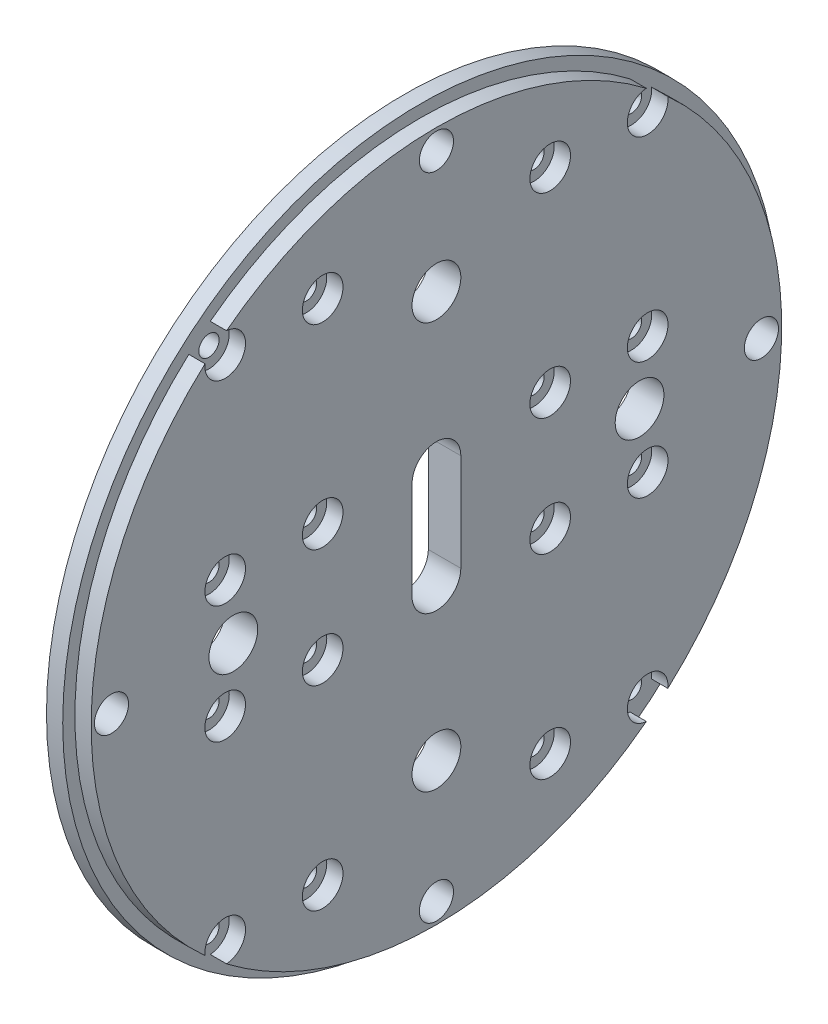
from build123d import *

# Parameters (mm, degrees)
CROQUIS1_R              = 44
SALIENTE_EXTRUIR1_DEPTH = 4
CROQUIS2_R              = 1.25
CORTAR_EXTRUIR2_DEPTH   = 63.353829072
CORTAR_EXTRUIR3_START   = -2
CROQUIS3_R              = 2.5
CORTAR_EXTRUIR3_DEPTH   = 61.353829072
CROQUIS4_R              = 3
CORTAR_EXTRUIR4_DEPTH   = 63.353829072
CROQUIS5_OUTSIDE_W      = 114.904
CROQUIS5_OUTSIDE_H      = 114.904
CROQUIS5_OUTSIDE_R      = 42.5
CORTAR_EXTRUIR5_DEPTH   = 2
CROQUIS6_R              = 2.1
CORTAR_EXTRUIR6_DEPTH   = 63.353829072


with BuildPart() as part:
    # Croquis1 → Saliente-Extruir1 (new body)
    with BuildSketch(Plane(origin=(0, 0, 0), x_dir=(0, 0, -1), z_dir=(1, 0, 0))):
        Circle(CROQUIS1_R)
    extrude(amount=SALIENTE_EXTRUIR1_DEPTH)

    # Croquis2 → Cortar-Extruir2 (cut, through all)
    with BuildSketch(Plane.ZY):
        with Locations((14, 7.25)):
            Circle(CROQUIS2_R)
        with Locations((26, 7.25)):
            Circle(CROQUIS2_R)
        with Locations((26, 31.25)):
            Circle(CROQUIS2_R)
        with Locations((14, 31.25)):
            Circle(CROQUIS2_R)
        with Locations(Location((-26, 31.25, 0), (0, 0, 180))):
            Circle(CROQUIS2_R)
        with Locations(Location((-14, 31.25, 0), (0, 0, 180))):
            Circle(CROQUIS2_R)
        with Locations(Location((-26, 7.25, 0), (0, 0, 180))):
            Circle(CROQUIS2_R)
        with Locations(Location((-14, 7.25, 0), (0, 0, 180))):
            Circle(CROQUIS2_R)
        with Locations((-14, -7.25)):
            Circle(CROQUIS2_R)
        with Locations((-26, -7.25)):
            Circle(CROQUIS2_R)
        with Locations((-14, -31.25)):
            Circle(CROQUIS2_R)
        with Locations((-26, -31.25)):
            Circle(CROQUIS2_R)
        with Locations(Location((14, -31.25, 0), (0, 0, 180))):
            Circle(CROQUIS2_R)
        with Locations(Location((26, -31.25, 0), (0, 0, 180))):
            Circle(CROQUIS2_R)
        with Locations(Location((26, -7.25, 0), (0, 0, 180))):
            Circle(CROQUIS2_R)
        with Locations(Location((14, -7.25, 0), (0, 0, 180))):
            Circle(CROQUIS2_R)
    extrude(amount=-CORTAR_EXTRUIR2_DEPTH, mode=Mode.SUBTRACT)

    # Croquis3 → Cortar-Extruir3 (cut, through all)
    with BuildSketch(Plane.ZY.offset(CORTAR_EXTRUIR3_START)):
        with Locations((14, 7.25)):
            Circle(CROQUIS3_R)
        with Locations((26, 7.25)):
            Circle(CROQUIS3_R)
        with Locations((26, 31.25)):
            Circle(CROQUIS3_R)
        with Locations((14, 31.25)):
            Circle(CROQUIS3_R)
        with Locations(Location((-26, 31.25, 0), (0, 0, 180))):
            Circle(CROQUIS3_R)
        with Locations(Location((-14, 31.25, 0), (0, 0, 180))):
            Circle(CROQUIS3_R)
        with Locations(Location((-26, 7.25, 0), (0, 0, 180))):
            Circle(CROQUIS3_R)
        with Locations(Location((-14, 7.25, 0), (0, 0, 180))):
            Circle(CROQUIS3_R)
        with Locations((-14, -7.25)):
            Circle(CROQUIS3_R)
        with Locations((-26, -7.25)):
            Circle(CROQUIS3_R)
        with Locations((-14, -31.25)):
            Circle(CROQUIS3_R)
        with Locations((-26, -31.25)):
            Circle(CROQUIS3_R)
        with Locations(Location((14, -31.25, 0), (0, 0, 180))):
            Circle(CROQUIS3_R)
        with Locations(Location((26, -31.25, 0), (0, 0, 180))):
            Circle(CROQUIS3_R)
        with Locations(Location((26, -7.25, 0), (0, 0, 180))):
            Circle(CROQUIS3_R)
        with Locations(Location((14, -7.25, 0), (0, 0, 180))):
            Circle(CROQUIS3_R)
    extrude(amount=-CORTAR_EXTRUIR3_DEPTH, mode=Mode.SUBTRACT)

    # Croquis4 → Cortar-Extruir4 (cut, through all)
    with BuildSketch(Plane.ZY):
        with Locations((0, 25)):
            Circle(CROQUIS4_R)
        with Locations((25, 0)):
            Circle(CROQUIS4_R)
        with Locations((0, -25)):
            Circle(CROQUIS4_R)
        with Locations((-25, 0)):
            Circle(CROQUIS4_R)
        with BuildLine():
            Line((3, 6), (3, -6))
            ThreePointArc((3, -6), (0, -9), (-3, -6))
            Line((-3, -6), (-3, 6))
            ThreePointArc((-3, 6), (0, 9), (3, 6))
        make_face()
    extrude(amount=-CORTAR_EXTRUIR4_DEPTH, mode=Mode.SUBTRACT)

    # Croquis5 outside → Cortar-Extruir5 (cut)
    with BuildSketch(Plane(origin=(4, 0, 0), x_dir=(0, 0, -1), z_dir=(1, 0, 0))):
        Rectangle(CROQUIS5_OUTSIDE_W, CROQUIS5_OUTSIDE_H)
        Circle(CROQUIS5_OUTSIDE_R, mode=Mode.SUBTRACT)
    extrude(amount=-CORTAR_EXTRUIR5_DEPTH, mode=Mode.SUBTRACT)

    # Croquis6 → Cortar-Extruir6 (cut, through all)
    with BuildSketch(Plane.ZY):
        with Locations((-40, 0)):
            Circle(CROQUIS6_R)
        with Locations((0, 40)):
            Circle(CROQUIS6_R)
        with Locations((40, 0)):
            Circle(CROQUIS6_R)
        with Locations((0, -40)):
            Circle(CROQUIS6_R)
    extrude(amount=-CORTAR_EXTRUIR6_DEPTH, mode=Mode.SUBTRACT)


solid = part.part
